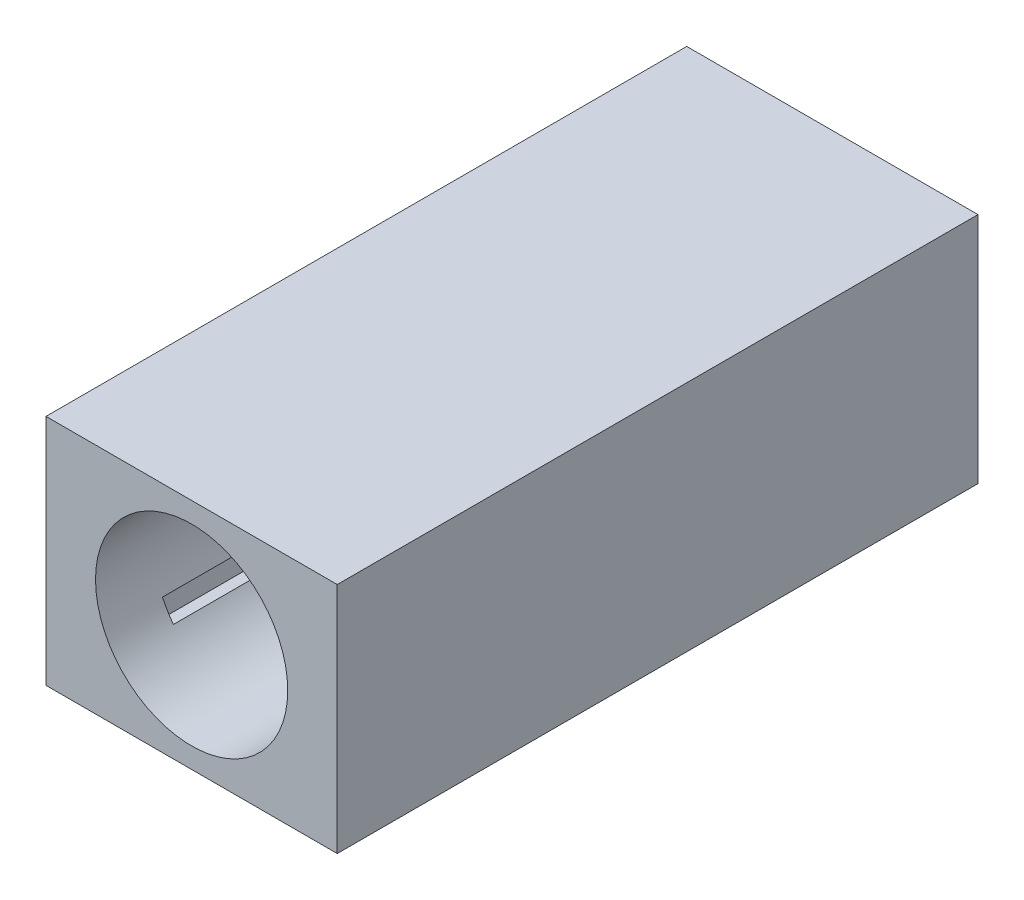
from build123d import *

# Parameters (mm, degrees)
SKETCH1_W           = 5
SKETCH1_H           = 4
SKETCH1_W_2         = 3
SKETCH1_H_2         = 2
BOSS_EXTRUDE1_DEPTH = 10
SKETCH2_W           = 5
SKETCH2_H           = 4
SKETCH2_R           = 1.65
BOSS_EXTRUDE2_DEPTH = 1
SKETCH3_R           = 1.65
CUT_EXTRUDE1_DEPTH  = 12.456439237


with BuildPart() as part:
    # Sketch1 → Boss-Extrude1 (new body)
    with BuildSketch(Plane.XY):
        Rectangle(SKETCH1_W, SKETCH1_H)
        Rectangle(SKETCH1_W_2, SKETCH1_H_2, mode=Mode.SUBTRACT)
    extrude(amount=BOSS_EXTRUDE1_DEPTH)

    # Sketch2 → Boss-Extrude2 (add)
    with BuildSketch(Plane.XY.offset(10)):
        Rectangle(SKETCH2_W, SKETCH2_H)
        with Locations(Location((0, 0, 0), (0, 0, 155.380022671))):
            Circle(SKETCH2_R, mode=Mode.SUBTRACT)
    extrude(amount=BOSS_EXTRUDE2_DEPTH)

    # Sketch3 → Cut-Extrude1 (cut, through all)
    with BuildSketch(Plane.XY.offset(11)):
        with Locations(Location((0, 0, 0), (0, 0, 155.380022671))):
            Circle(SKETCH3_R)
    extrude(amount=-CUT_EXTRUDE1_DEPTH, mode=Mode.SUBTRACT)


solid = part.part
